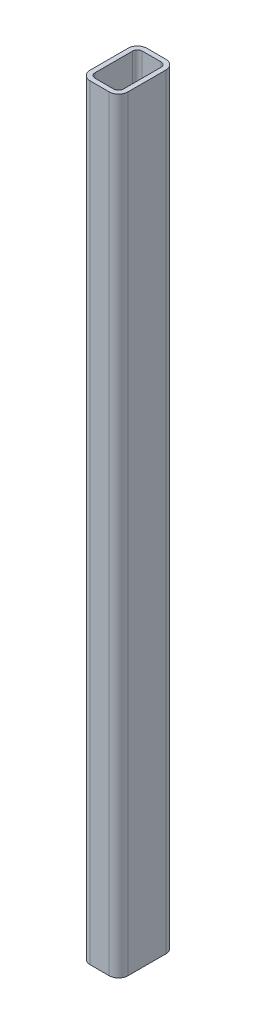
from build123d import *

# Parameters (mm, degrees)
TUBO_RECTANGULAR_3_X_2_X_0_25_1_DEPTH = 1030


with BuildPart() as part:
    # Sketch1 → Tubo rectangular 3 X 2 X 0.25(1) (new body)
    with BuildSketch(Plane(origin=(0, 0, 0), x_dir=(-1, 0, 0), z_dir=(0, 1, 0))):
        with BuildLine():
            Line((-12.699978, -38.1), (12.699978, -38.1))
            ThreePointArc((12.699978, -38.1), (21.680234121, -34.380256121), (25.399978, -25.4))
            Line((25.399978, -25.4), (25.399978, 25.4))
            ThreePointArc((25.399978, 25.4), (21.680234121, 34.380256121), (12.699978, 38.1))
            Line((12.699978, 38.1), (-12.699978, 38.1))
            ThreePointArc((-12.699978, 38.1), (-21.680234121, 34.380256121), (-25.399978, 25.4))
            Line((-25.399978, 25.4), (-25.399978, -25.4))
            ThreePointArc((-25.399978, -25.4), (-21.680234121, -34.380256121), (-12.699978, -38.1))
        make_face()
        with BuildLine():
            Line((-12.699978, -31.75), (12.699978, -31.75))
            ThreePointArc((12.699978, -31.75), (17.190106061, -29.890128061), (19.049978, -25.4))
            Line((19.049978, -25.4), (19.049978, 25.4))
            ThreePointArc((19.049978, 25.4), (17.190106061, 29.890128061), (12.699978, 31.75))
            Line((12.699978, 31.75), (-12.699978, 31.75))
            ThreePointArc((-12.699978, 31.75), (-17.190106061, 29.890128061), (-19.049978, 25.4))
            Line((-19.049978, 25.4), (-19.049978, -25.4))
            ThreePointArc((-19.049978, -25.4), (-17.190106061, -29.890128061), (-12.699978, -31.75))
        make_face(mode=Mode.SUBTRACT)
    extrude(amount=TUBO_RECTANGULAR_3_X_2_X_0_25_1_DEPTH)


solid = part.part
